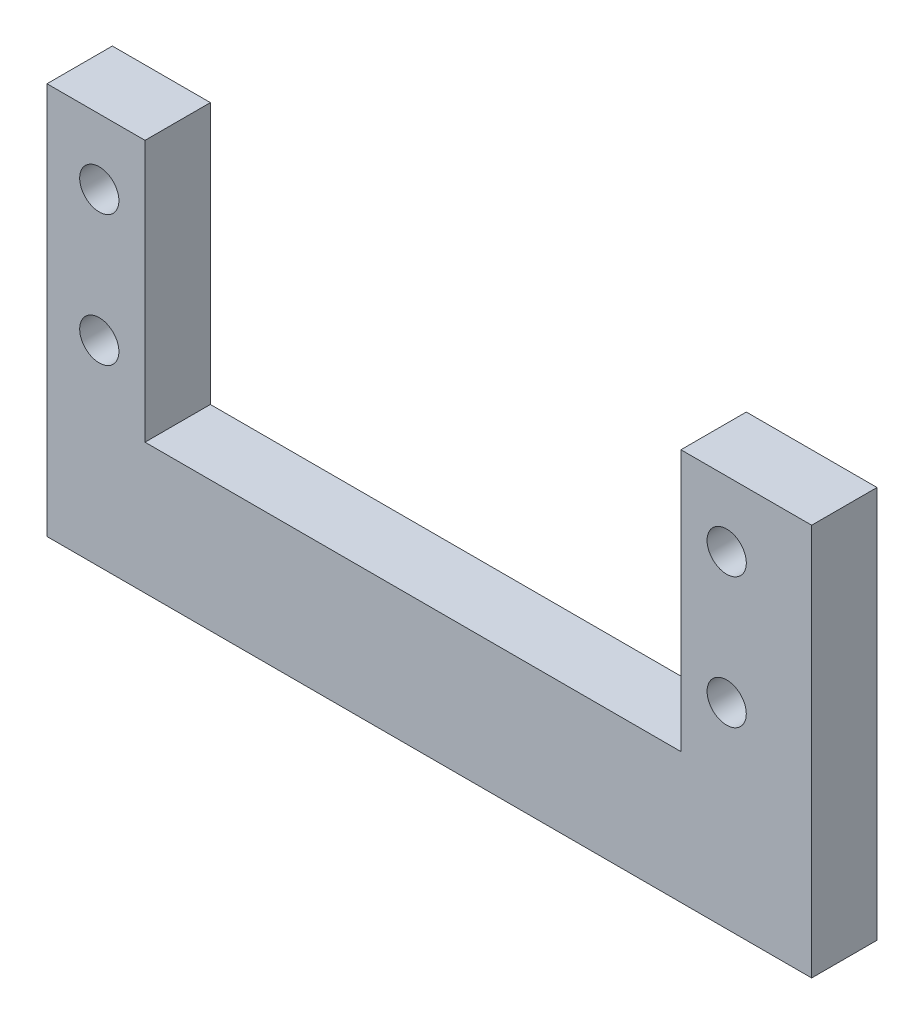
from build123d import *

# Parameters (mm, degrees)
ESQUISSE1_R        = 1.5
BOSS_EXTRU_1_DEPTH = 5


with BuildPart() as part:
    # Esquisse1 → Boss.-Extru.1 (new body)
    with BuildSketch(Plane.XY):
        Polygon((48.5, 30), (58.5, 30), (58.5, 0), (0, 0), (0, 30), (7.5, 30), (7.5, 10), (48.5, 10), align=None)
        with Locations((4, 25)):
            Circle(ESQUISSE1_R, mode=Mode.SUBTRACT)
        with Locations(Location((4, 15, 0), (0, 0, 180))):
            Circle(ESQUISSE1_R, mode=Mode.SUBTRACT)
        with Locations((52, 15)):
            Circle(ESQUISSE1_R, mode=Mode.SUBTRACT)
        with Locations(Location((52, 25, 0), (0, 0, 180))):
            Circle(ESQUISSE1_R, mode=Mode.SUBTRACT)
    extrude(amount=BOSS_EXTRU_1_DEPTH)


solid = part.part
